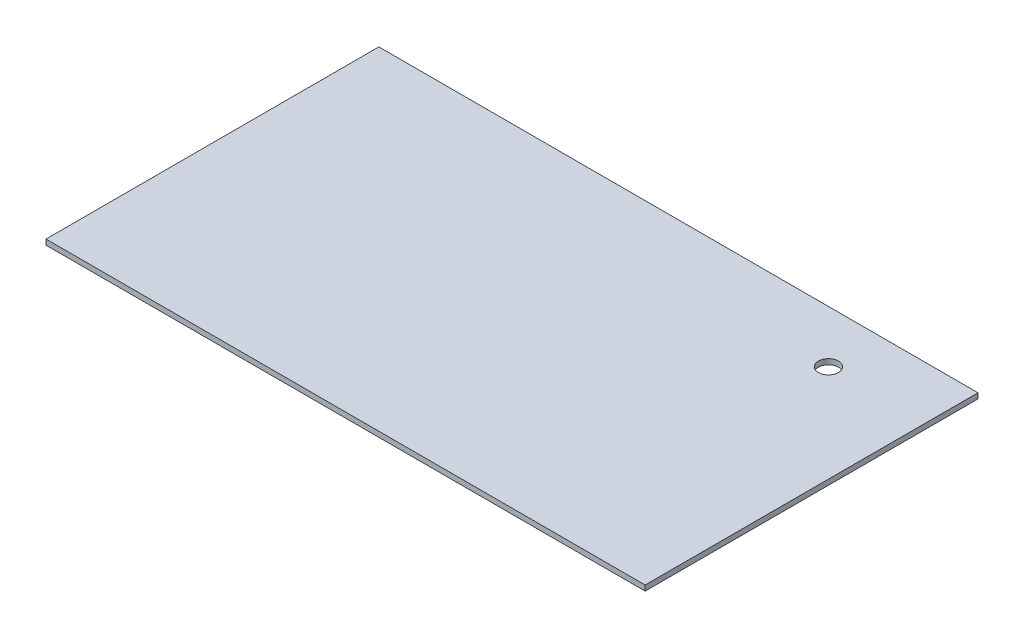
from build123d import *

# Parameters (mm, degrees)
SKETCH_1_W          = 450
SKETCH_1_H          = 250
EXTRUDE_1_DEPTH     = 4
SKETCH_2_R          = 7.5
CUT_EXTRUDE_1_DEPTH = 515.797047389


with BuildPart() as part:
    # 草圖1 → 填料-伸長1 (new body)
    with BuildSketch(Plane(origin=(0, 0, 0), x_dir=(1, 0, 0), z_dir=(0, 1, 0))):
        with Locations((225, 125)):
            Rectangle(SKETCH_1_W, SKETCH_1_H)
    extrude(amount=EXTRUDE_1_DEPTH)

    # 草圖2 → 除料-伸長1 (cut, through all)
    with BuildSketch(Plane(origin=(0, 4, 0), x_dir=(1, 0, 0), z_dir=(0, 1, 0))):
        with Locations(Location((376.92, 210.73, 0), (0, 0, 270))):
            Circle(SKETCH_2_R)
    extrude(amount=-CUT_EXTRUDE_1_DEPTH, mode=Mode.SUBTRACT)


solid = part.part
